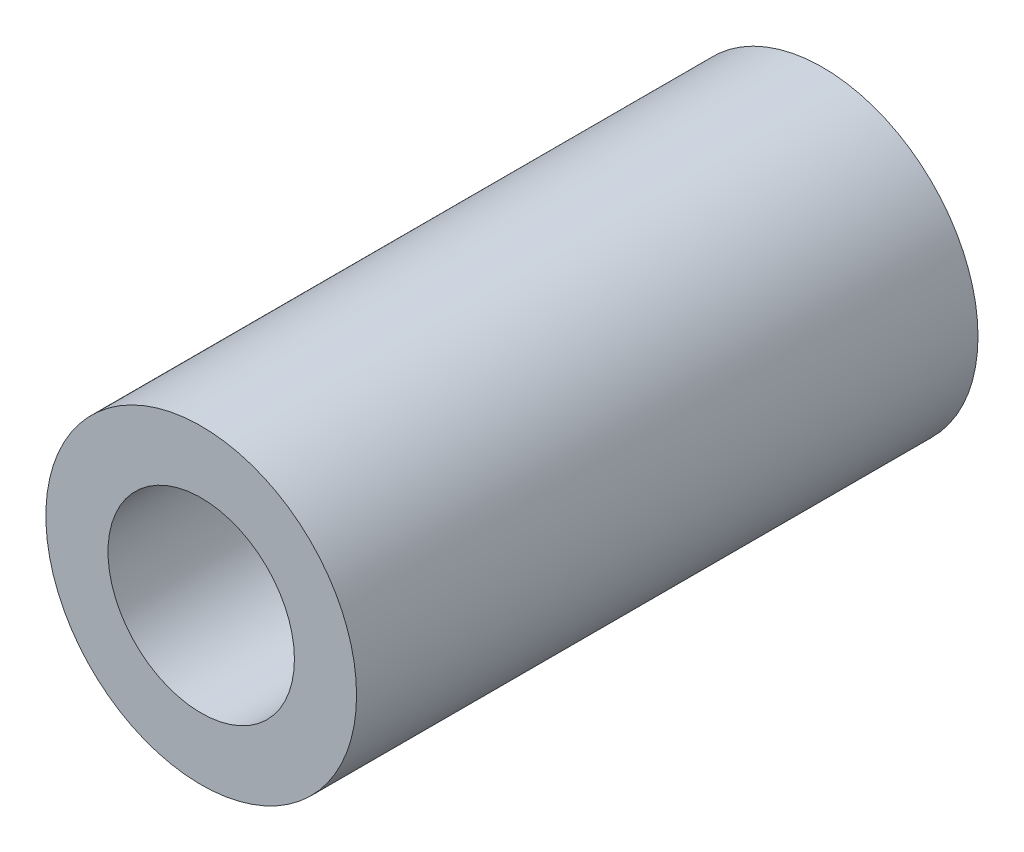
from build123d import *

# Parameters (mm, degrees)
SKETCH_1_R      = 2.5
SKETCH_1_R_2    = 1.5
EXTRUDE_1_DEPTH = 10


with BuildPart() as part:
    # 草图1 → 凸台-拉伸1 (new body)
    with BuildSketch(Plane.XY):
        Circle(SKETCH_1_R)
        Circle(SKETCH_1_R_2, mode=Mode.SUBTRACT)
    extrude(amount=EXTRUDE_1_DEPTH)


solid = part.part
